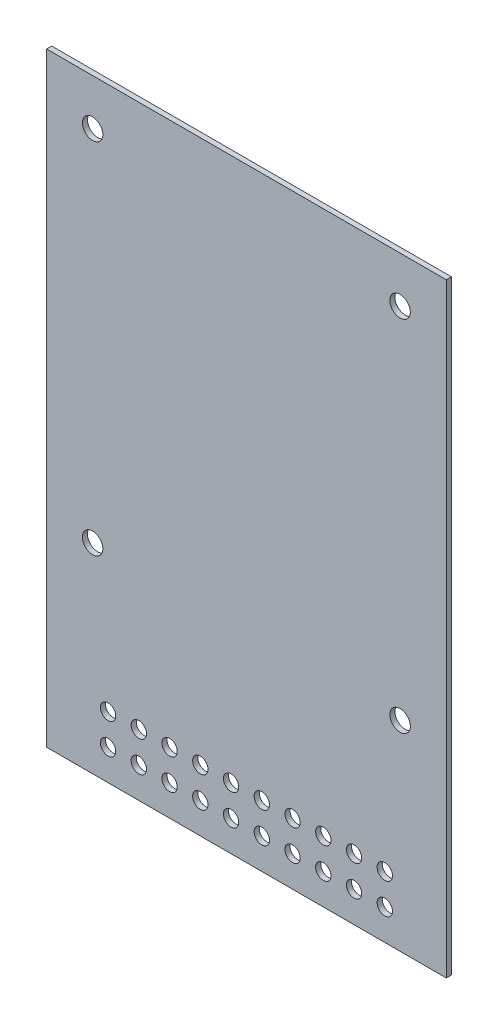
from build123d import *

# Parameters (mm, degrees)
SKETCH1_W           = 78
SKETCH1_H           = 118
BOSS_EXTRUDE1_DEPTH = 1
SKETCH2_R           = 2
SKETCH2_R_2         = 1.5
CUT_EXTRUDE1_DEPTH  = 142.453172464


with BuildPart() as part:
    # Sketch1 → Boss-Extrude1 (new body)
    with BuildSketch(Plane.XY):
        with Locations((39, 59)):
            Rectangle(SKETCH1_W, SKETCH1_H)
    extrude(amount=BOSS_EXTRUDE1_DEPTH)

    # Sketch2 → Cut-Extrude1 (cut, through all)
    with BuildSketch(Plane(origin=(0, 0, 0), x_dir=(-1, 0, 0), z_dir=(0, 0, -1))):
        with Locations((-8.980393049, 39.016810723)):
            Circle(SKETCH2_R)
        with Locations((-68.980393049, 39.016810723)):
            Circle(SKETCH2_R)
        with Locations((-68.980393049, 109.016810723)):
            Circle(SKETCH2_R)
        with Locations((-8.980393049, 109.016810723)):
            Circle(SKETCH2_R)
        with Locations((-66, 12)):
            Circle(SKETCH2_R_2)
        with Locations((-60, 12)):
            Circle(SKETCH2_R_2)
        with Locations((-54, 12)):
            Circle(SKETCH2_R_2)
        with Locations((-48, 12)):
            Circle(SKETCH2_R_2)
        with Locations((-42, 12)):
            Circle(SKETCH2_R_2)
        with Locations((-36, 12)):
            Circle(SKETCH2_R_2)
        with Locations((-30, 12)):
            Circle(SKETCH2_R_2)
        with Locations((-24, 12)):
            Circle(SKETCH2_R_2)
        with Locations((-18, 12)):
            Circle(SKETCH2_R_2)
        with Locations((-12, 12)):
            Circle(SKETCH2_R_2)
        with Locations((-60, 6)):
            Circle(SKETCH2_R_2)
        with Locations((-54, 6)):
            Circle(SKETCH2_R_2)
        with Locations((-48, 6)):
            Circle(SKETCH2_R_2)
        with Locations((-42, 6)):
            Circle(SKETCH2_R_2)
        with Locations((-36, 6)):
            Circle(SKETCH2_R_2)
        with Locations((-30, 6)):
            Circle(SKETCH2_R_2)
        with Locations((-24, 6)):
            Circle(SKETCH2_R_2)
        with Locations((-18, 6)):
            Circle(SKETCH2_R_2)
        with Locations((-12, 6)):
            Circle(SKETCH2_R_2)
        with Locations((-66, 6)):
            Circle(SKETCH2_R_2)
    extrude(amount=-CUT_EXTRUDE1_DEPTH, mode=Mode.SUBTRACT)


solid = part.part
